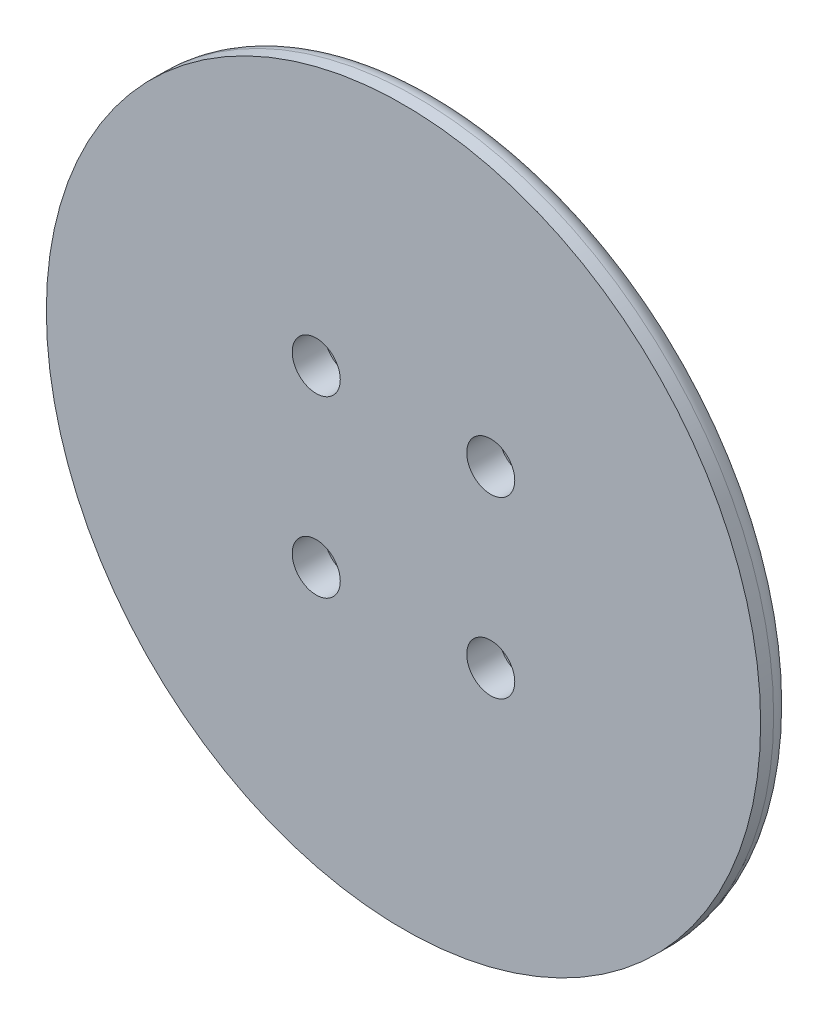
from build123d import *

# Parameters (mm, degrees)
SKETCH_1_R      = 32.5
SKETCH_1_R_2    = 1.7
EXTRUDE_1_DEPTH = 5
SKETCH_2_R      = 55
SKETCH_2_R_2    = 3.7
EXTRUDE_2_DEPTH = 5
FILLET_2_R      = 3
FILLET_3_R      = 3


with BuildPart() as part:
    # 草图1 → 凸台-拉伸1 (new body)
    with BuildSketch(Plane.XY):
        Circle(SKETCH_1_R)
        with Locations((-13.435028843, 13.435028843)):
            Circle(SKETCH_1_R_2, mode=Mode.SUBTRACT)
        with Locations((-13.435028843, -13.435028843)):
            Circle(SKETCH_1_R_2, mode=Mode.SUBTRACT)
        with Locations((13.435028843, -13.435028843)):
            Circle(SKETCH_1_R_2, mode=Mode.SUBTRACT)
        with Locations((13.435028843, 13.435028843)):
            Circle(SKETCH_1_R_2, mode=Mode.SUBTRACT)
    extrude(amount=EXTRUDE_1_DEPTH)

    # 草图2 → 凸台-拉伸2 (add)
    with BuildSketch(Plane.XY.offset(5)):
        Circle(SKETCH_2_R)
        with Locations((13.435028843, -13.435028843)):
            Circle(SKETCH_2_R_2, mode=Mode.SUBTRACT)
        with Locations((-13.435028843, 13.435028843)):
            Circle(SKETCH_2_R_2, mode=Mode.SUBTRACT)
        with Locations((-13.435028843, -13.435028843)):
            Circle(SKETCH_2_R_2, mode=Mode.SUBTRACT)
        with Locations((13.435028843, 13.435028843)):
            Circle(SKETCH_2_R_2, mode=Mode.SUBTRACT)
    extrude(amount=EXTRUDE_2_DEPTH)

    # 圆角2
    fillet_2_edges = [part.edges().sort_by_distance(p)[0] for p in [
        (-32.5, 0, 0),
    ]]
    fillet(fillet_2_edges, radius=FILLET_2_R)

    # 圆角3
    fillet_3_edges = [part.edges().sort_by_distance(p)[0] for p in [
        (-55, 0, 5),
    ]]
    fillet(fillet_3_edges, radius=FILLET_3_R)


solid = part.part
